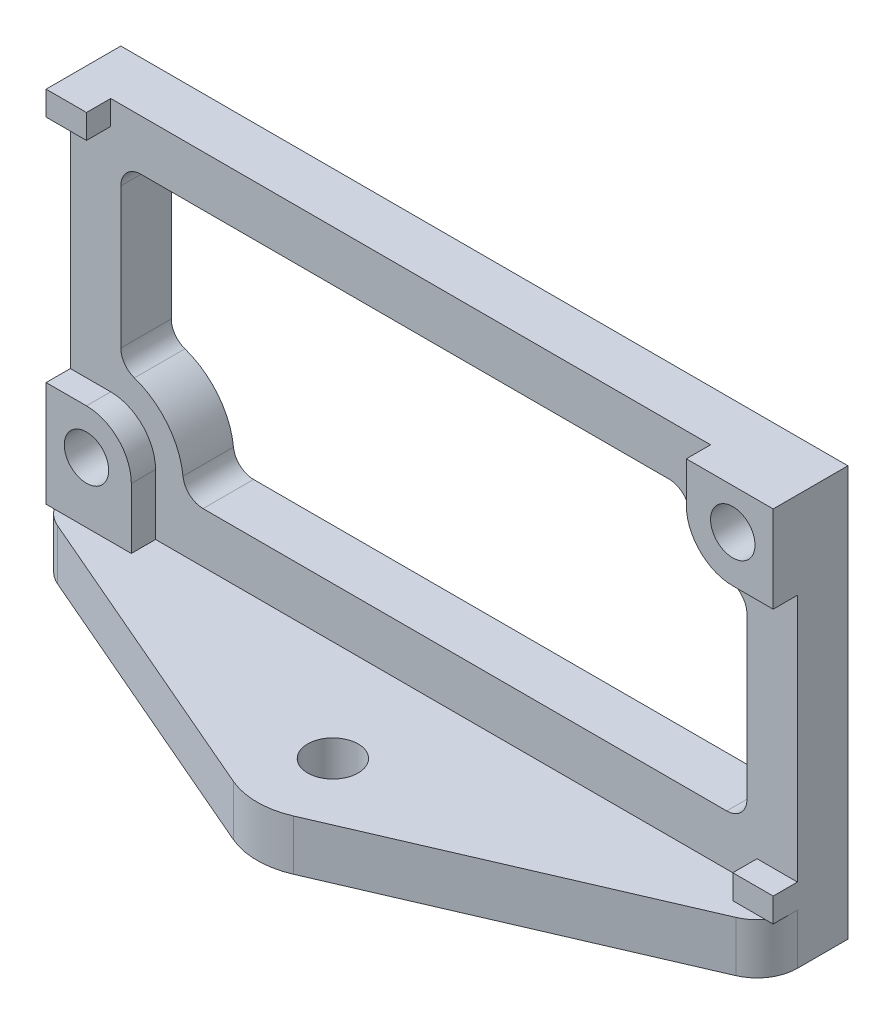
from build123d import *

# Parameters (mm, degrees)
SKETCH1_W           = 45.72
SKETCH1_H           = 22.606
SKETCH1_R           = 1.397
BOSS_EXTRUDE1_DEPTH = 3.175
SKETCH3_R           = 1.5875
BOSS_EXTRUDE2_DEPTH = 3.175
CUT_EXTRUDE1_DEPTH  = 53.966803682
SKETCH5_R           = 1.397
SKETCH5_W           = 2.54
SKETCH5_H           = 1.524
BOSS_EXTRUDE3_DEPTH = 1.524


with BuildPart() as part:
    # Sketch1 → Boss-Extrude1 (new body)
    with BuildSketch(Plane.XY):
        with Locations((22.86, 11.303)):
            Rectangle(SKETCH1_W, SKETCH1_H)
        with Locations((2.54, 3.81)):
            Circle(SKETCH1_R, mode=Mode.SUBTRACT)
        with Locations((43.18, 20.066)):
            Circle(SKETCH1_R, mode=Mode.SUBTRACT)
    extrude(amount=BOSS_EXTRUDE1_DEPTH)

    # Sketch3 → Boss-Extrude2 (add)
    with BuildSketch(Plane(origin=(0, 0, 0), x_dir=(1, 0, 0), z_dir=(0, 1, 0))):
        with BuildLine():
            Line((0, -3.175), (0, 0))
            Line((0, 0), (45.72, 0))
            Line((45.72, 0), (45.72, -3.175))
            ThreePointArc((45.72, -3.175), (45.302298274, -4.570510672), (44.186574776, -5.507039284))
            Line((44.186574776, -5.507039284), (24.747327705, -13.897573657))
            ThreePointArc((24.747327705, -13.897573657), (22.86, -14.2875), (20.972672295, -13.897573657))
            Line((20.972672295, -13.897573657), (1.533425224, -5.507039284))
            ThreePointArc((1.533425224, -5.507039284), (0.417701726, -4.570510672), (0, -3.175))
        make_face()
        with Locations(Location((22.86, -9.525, 0), (0, 0, 270))):
            Circle(SKETCH3_R, mode=Mode.SUBTRACT)
    extrude(amount=-BOSS_EXTRUDE2_DEPTH)

    # Sketch4 → Cut-Extrude1 (cut, through all)
    with BuildSketch(Plane.XY):
        with BuildLine():
            Line((3.175, 18.161), (3.175, 9.332674986))
            ThreePointArc((3.175, 9.332674986), (3.410870982, 8.595465942), (4.030869565, 8.132093467))
            ThreePointArc((4.030869565, 8.132093467), (6.112895277, 6.662648479), (7.084911244, 4.306956522))
            ThreePointArc((7.084911244, 4.306956522), (7.499570341, 3.499427365), (8.34738659, 3.175))
            Line((8.34738659, 3.175), (41.275, 3.175))
            ThreePointArc((41.275, 3.175), (42.173025612, 3.546974388), (42.545, 4.445))
            Line((42.545, 4.445), (42.545, 14.543325014))
            ThreePointArc((42.545, 14.543325014), (42.309129018, 15.280534058), (41.689130435, 15.743906533))
            ThreePointArc((41.689130435, 15.743906533), (39.947107796, 16.833107796), (38.857906533, 18.575130435))
            ThreePointArc((38.857906533, 18.575130435), (38.394534058, 19.195129018), (37.657325014, 19.431))
            Line((37.657325014, 19.431), (4.445, 19.431))
            ThreePointArc((4.445, 19.431), (3.546974388, 19.059025612), (3.175, 18.161))
        make_face()
    extrude(amount=CUT_EXTRUDE1_DEPTH, mode=Mode.SUBTRACT)

    # Sketch5 → Boss-Extrude3 (add)
    # profile 1 of 4: a face of its own
    with BuildSketch(Plane.XY.offset(3.175)):
        with BuildLine():
            Line((2.54, 6.6294), (0, 6.6294))
            Line((0, 6.6294), (0, 0))
            Line((0, 0), (5.3594, 0))
            Line((5.3594, 0), (5.3594, 3.81))
            ThreePointArc((5.3594, 3.81), (4.533616859, 5.803616859), (2.54, 6.6294))
        make_face()
        with Locations((2.54, 3.81)):
            Circle(SKETCH5_R, mode=Mode.SUBTRACT)
    # profile 2 of 4: a face of its own
    with BuildSketch(Plane.XY.offset(3.175)):
        with BuildLine():
            Line((40.259, 20.066), (40.259, 22.606))
            Line((40.259, 22.606), (45.72, 22.606))
            Line((45.72, 22.606), (45.72, 17.145))
            Line((45.72, 17.145), (43.18, 17.145))
            ThreePointArc((43.18, 17.145), (41.114541092, 18.000541092), (40.259, 20.066))
        make_face()
        with Locations((43.18, 20.066)):
            Circle(SKETCH5_R, mode=Mode.SUBTRACT)
    # profile 3 of 4: a face of its own
    with BuildSketch(Plane.XY.offset(3.175)):
        with Locations((1.27, 21.844)):
            Rectangle(SKETCH5_W, SKETCH5_H)
    # profile 4 of 4: a face of its own
    with BuildSketch(Plane.XY.offset(3.175)):
        with Locations((44.45, 0.762)):
            Rectangle(SKETCH5_W, SKETCH5_H)
    extrude(amount=BOSS_EXTRUDE3_DEPTH)


solid = part.part
